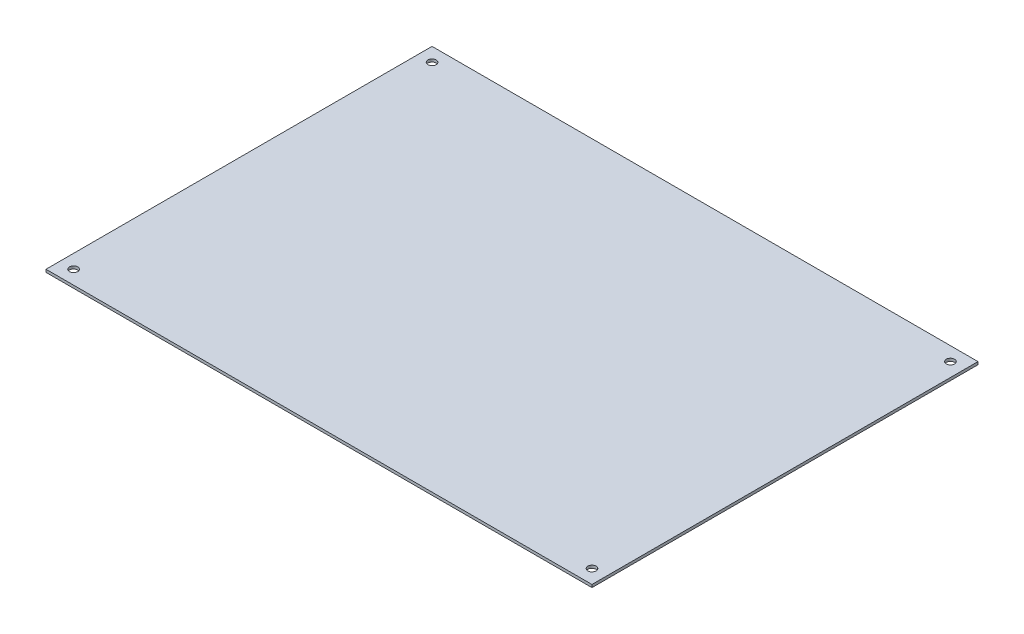
from build123d import *

# Parameters (mm, degrees)
SKETCH1_W            = 297
SKETCH1_H            = 210
BOSS_EXTRUDE1_DEPTH  = 1.5
M4_CLEARANCE_HOLE1_D = 4.5


with BuildPart() as part:
    # Sketch1 → Boss-Extrude1 (new body)
    with BuildSketch(Plane(origin=(0, 0, 0), x_dir=(1, 0, 0), z_dir=(0, 1, 0))):
        Rectangle(SKETCH1_W, SKETCH1_H)
    extrude(amount=BOSS_EXTRUDE1_DEPTH)

    # M4 Clearance Hole1 (through all)
    with Locations(Plane(origin=(0, 1.5, 0), x_dir=(1, 0, 0), z_dir=(0, 1, 0))):
        with Locations((-140.9999974, 97.5000082), (-140.9999974, -97.5000082), (140.9999974, -97.5000082), (140.9999974, 97.5000082)):
            Hole(M4_CLEARANCE_HOLE1_D / 2)


solid = part.part
